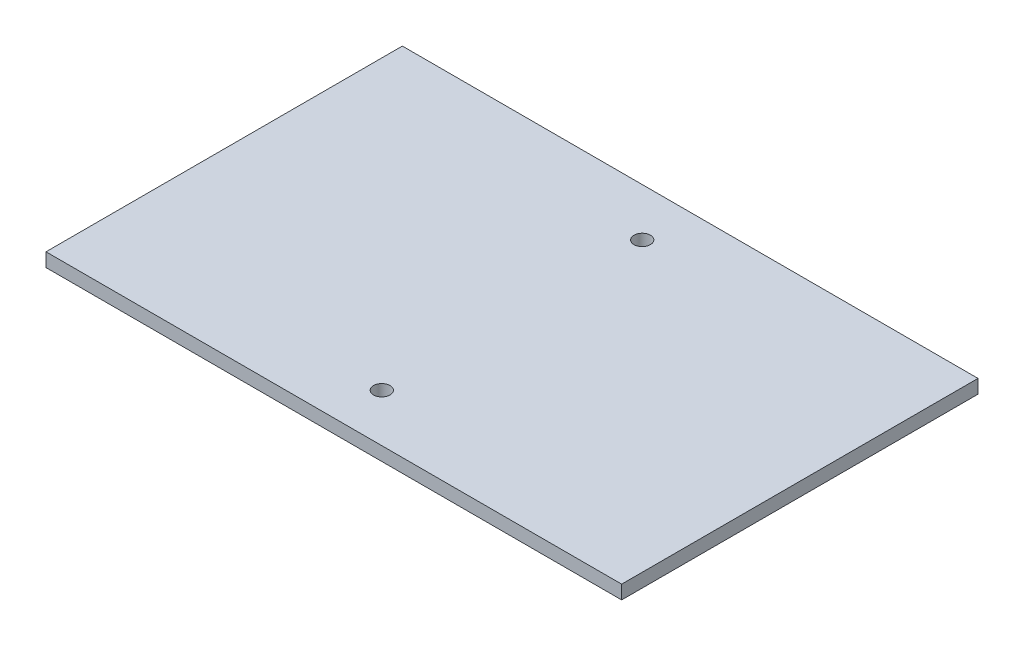
from build123d import *

# Parameters (mm, degrees)
SKETCH1_W           = 210
SKETCH1_H           = 120
BOSS_EXTRUDE1_DEPTH = 5
SKETCH3_R           = 3
CUT_EXTRUDE1_DEPTH  = 10
SKETCH4_W           = 210
SKETCH4_H           = 5
BOSS_EXTRUDE2_DEPTH = 5
SKETCH5_W           = 210
SKETCH5_H           = 5
BOSS_EXTRUDE3_DEPTH = 5


with BuildPart() as part:
    # Sketch1 → Boss-Extrude1 (new body)
    with BuildSketch(Plane(origin=(0, 0, 0), x_dir=(1, 0, 0), z_dir=(0, 1, 0))):
        Rectangle(SKETCH1_W, SKETCH1_H)
    extrude(amount=BOSS_EXTRUDE1_DEPTH)

    # Sketch3 → Cut-Extrude1 (cut)
    with BuildSketch(Plane(origin=(0, 5, 0), x_dir=(1, 0, 0), z_dir=(0, 1, 0))):
        with Locations(Location((0, 47.5, 0), (0, 0, 270))):
            Circle(SKETCH3_R)
        with Locations(Location((0, -47.5, 0), (0, 0, 270))):
            Circle(SKETCH3_R)
    extrude(amount=-CUT_EXTRUDE1_DEPTH, mode=Mode.SUBTRACT)

    # Sketch4 → Boss-Extrude2 (add)
    with BuildSketch(Plane.XY.offset(60)):
        with Locations((0, 2.5)):
            Rectangle(SKETCH4_W, SKETCH4_H)
    extrude(amount=BOSS_EXTRUDE2_DEPTH)

    # Sketch5 → Boss-Extrude3 (add)
    with BuildSketch(Plane(origin=(0, 0, -60), x_dir=(-1, 0, 0), z_dir=(0, 0, -1))):
        with Locations((0, 2.5)):
            Rectangle(SKETCH5_W, SKETCH5_H)
    extrude(amount=BOSS_EXTRUDE3_DEPTH)


solid = part.part
